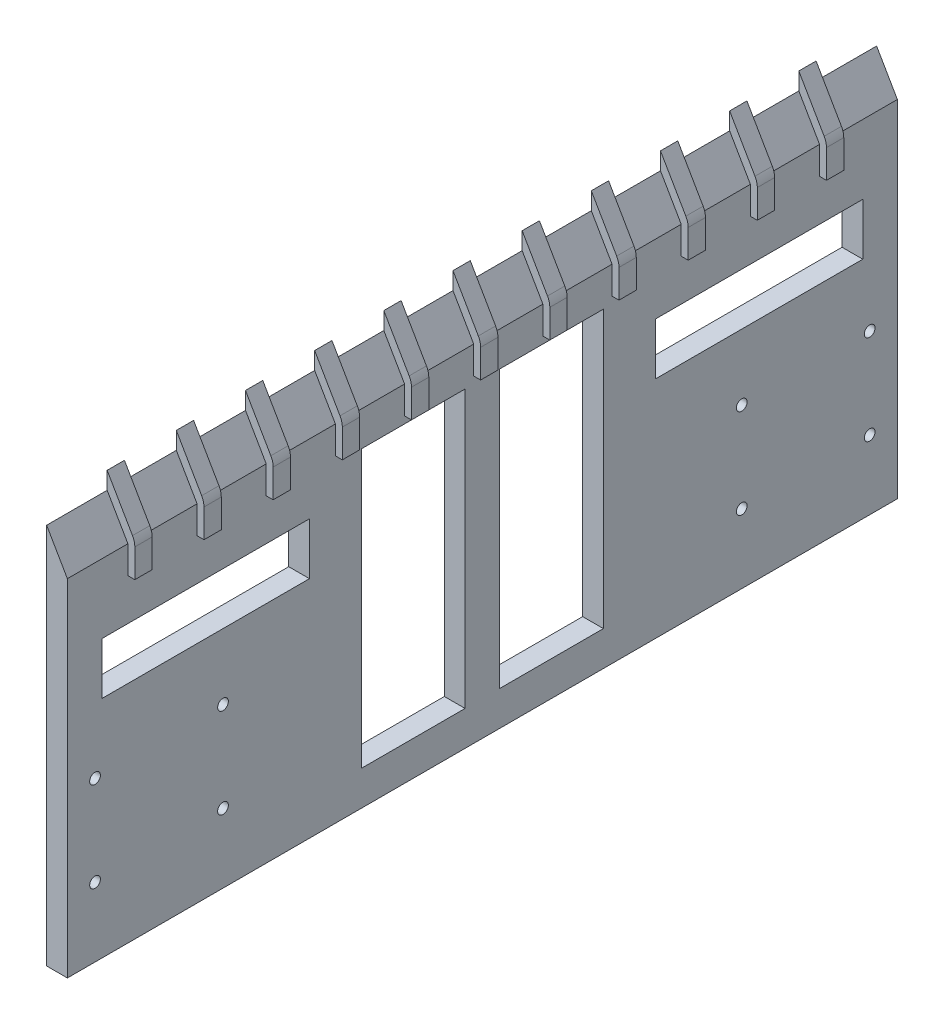
from build123d import *

# Parameters (mm, degrees)
SKETCH_1_W                 = 240
SKETCH_1_H                 = 100
EXTRUDE_1_DEPTH            = 6
SKETCH_2_R                 = 1.55
CUT_EXTRUDE_1_DEPTH        = 261.069221555
SKETCH_3_W                 = 60
SKETCH_3_H                 = 15
CUT_EXTRUDE_2_DEPTH        = 261.069221555
SKETCH_4_W                 = 30
SKETCH_4_H                 = 80
CUT_EXTRUDE_3_DEPTH        = 261.069221555
SKETCH_5_R                 = 3
CUT_EXTRUDE_4_DEPTH        = 3
EXTRUDE_2_DEPTH            = 240
EXTRUDE_3_DEPTH            = 5
PATTERN_LINEAR_5_COUNT     = 6
PATTERN_LINEAR_5_PITCH     = 20
PATTERN_LINEAR_5_COL_COUNT = 6
PATTERN_LINEAR_5_COL_PITCH = 20
FILLET_5_R                 = 5


with BuildPart() as part:
    # 草图1 → 凸台-拉伸1 (new body)
    with BuildSketch(Plane(origin=(0, 0, 0), x_dir=(0, 0, -1), z_dir=(1, 0, 0))):
        with Locations((120, -50)):
            Rectangle(SKETCH_1_W, SKETCH_1_H)
    extrude(amount=EXTRUDE_1_DEPTH)

    # 草图2 → 切除-拉伸1 (cut, through all)
    with BuildSketch(Plane(origin=(6, 0, 0), x_dir=(0, 0, -1), z_dir=(1, 0, 0))):
        with Locations((8, -54)):
            Circle(SKETCH_2_R)
        with Locations((45, -80)):
            Circle(SKETCH_2_R)
        with Locations((45, -54)):
            Circle(SKETCH_2_R)
        with Locations((8, -80)):
            Circle(SKETCH_2_R)
        with Locations(Location((232, -80, 0), (0, 0, 180))):
            Circle(SKETCH_2_R)
        with Locations(Location((195, -54, 0), (0, 0, 180))):
            Circle(SKETCH_2_R)
        with Locations(Location((195, -80, 0), (0, 0, 180))):
            Circle(SKETCH_2_R)
        with Locations(Location((232, -54, 0), (0, 0, 180))):
            Circle(SKETCH_2_R)
    extrude(amount=-CUT_EXTRUDE_1_DEPTH, mode=Mode.SUBTRACT)

    # 草图3 → 切除-拉伸2 (cut, through all)
    with BuildSketch(Plane(origin=(6, 0, 0), x_dir=(0, 0, -1), z_dir=(1, 0, 0))):
        with Locations((40, -27.5)):
            Rectangle(SKETCH_3_W, SKETCH_3_H)
        with Locations((200, -27.5)):
            Rectangle(SKETCH_3_W, SKETCH_3_H)
    extrude(amount=-CUT_EXTRUDE_2_DEPTH, mode=Mode.SUBTRACT)

    # 草图4 → 切除-拉伸3 (cut, through all)
    with BuildSketch(Plane(origin=(6, 0, 0), x_dir=(0, 0, -1), z_dir=(1, 0, 0))):
        with Locations((100, -50)):
            Rectangle(SKETCH_4_W, SKETCH_4_H)
        with Locations((140, -50)):
            Rectangle(SKETCH_4_W, SKETCH_4_H)
    extrude(amount=-CUT_EXTRUDE_3_DEPTH, mode=Mode.SUBTRACT)

    # 草图5 → 切除-拉伸4 (cut)
    with BuildSketch(Plane.ZY):
        with Locations((-195, -80)):
            Circle(SKETCH_5_R)
        with Locations((-232, -80)):
            Circle(SKETCH_5_R)
        with Locations((-195, -54)):
            Circle(SKETCH_5_R)
        with Locations((-232, -54)):
            Circle(SKETCH_5_R)
        with Locations((-45, -80)):
            Circle(SKETCH_5_R)
        with Locations((-8, -80)):
            Circle(SKETCH_5_R)
        with Locations((-8, -54)):
            Circle(SKETCH_5_R)
        with Locations((-45, -54)):
            Circle(SKETCH_5_R)
    extrude(amount=-CUT_EXTRUDE_4_DEPTH, mode=Mode.SUBTRACT)

    # 草图6 → 凸台-拉伸2 (add)
    with BuildSketch(Plane.XY):
        Polygon((6, 0), (0, 0), (0, 10.392304845), align=None)
    extrude(amount=-EXTRUDE_2_DEPTH)

    # 草图7 → 凸台-拉伸3 (add)
    with BuildSketch(Plane.XY.offset(-117.5)):
        Polygon((0, 10.392304845), (0, 15.392304845), (8, 1.535898385), (8, -8), (6, -8), (6, 0), align=None)
    extrude_3 = extrude(amount=-EXTRUDE_3_DEPTH)

    # 阵列(线性)5: 凸台-拉伸3 ×6
    with Locations(*[(0, 0, i * PATTERN_LINEAR_5_PITCH) for i in range(1, PATTERN_LINEAR_5_COUNT)]):
        add(extrude_3)

    # 阵列(线性)5 col: 凸台-拉伸3 ×6
    with Locations(*[(0, 0, -i * PATTERN_LINEAR_5_COL_PITCH) for i in range(1, PATTERN_LINEAR_5_COL_COUNT)]):
        add(extrude_3)

    # 圆角5
    fillet_5_edges = [part.edges().sort_by_distance(p)[0] for p in [
        (8, 1.535898385, -120),
        (8, 1.535898385, -140),
        (8, 1.535898385, -160),
        (8, 1.535898385, -180),
        (8, 1.535898385, -200),
        (8, 1.535898385, -220),
        (8, 1.535898385, -100),
        (8, 1.535898385, -80),
        (8, 1.535898385, -60),
        (8, 1.535898385, -40),
        (8, 1.535898385, -20),
    ]]
    fillet(fillet_5_edges, radius=FILLET_5_R)


solid = part.part
